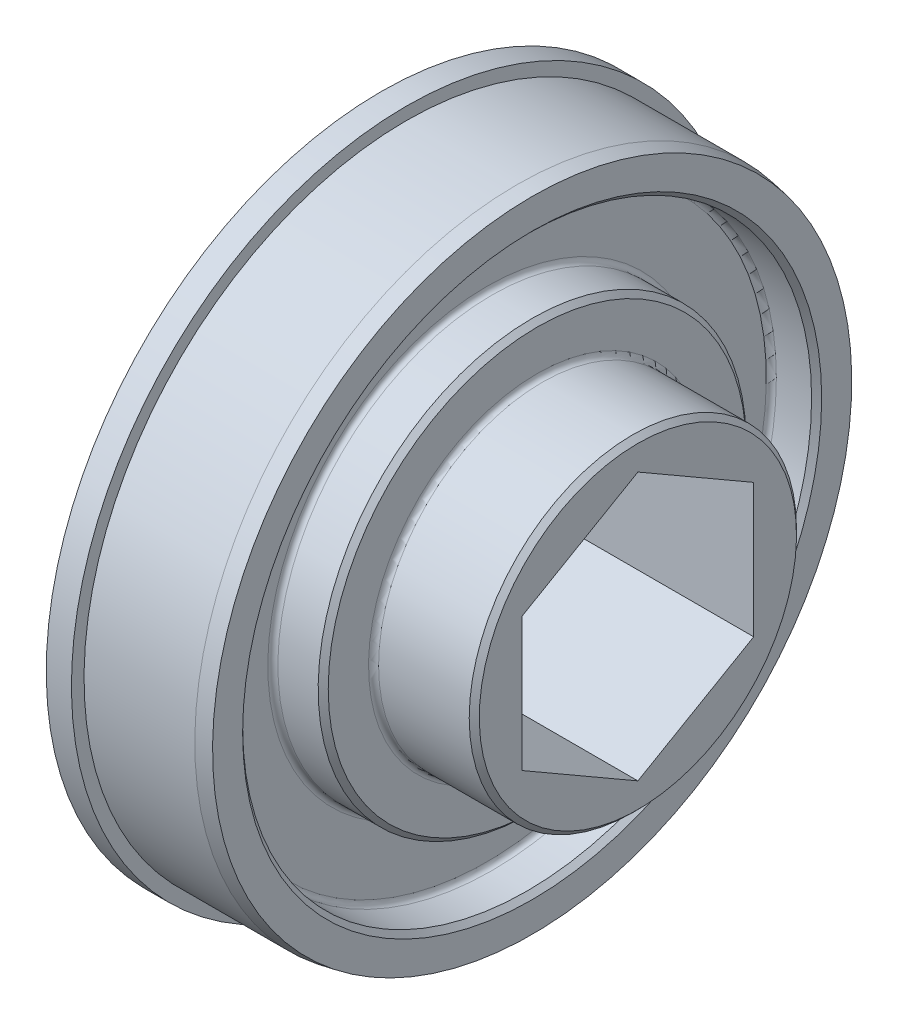
from build123d import *

# Parameters (mm, degrees)
CUT_EXTRUDE_1_DEPTH = 119.441968913


with BuildPart() as part:
    # Эскиз1 → Повернуть1 (revolve)
    with BuildSketch(Plane.XY):
        with BuildLine():
            Line((0, 0), (-57, 0))
            Line((-57, 0), (-57, 27.5))
            Line((-57, 27.5), (-72, 27.5))
            Line((-72, 27.5), (-72, 31.5))
            Line((-72, 31.5), (-71, 32.5))
            Line((-71, 32.5), (-53, 32.5))
            ThreePointArc((-53, 32.5), (-52.292893219, 32.792893219), (-52, 33.5))
            Line((-52, 33.5), (-52, 41.5))
            Line((-52, 41.5), (-51, 42.5))
            Line((-51, 42.5), (-43, 42.5))
            ThreePointArc((-43, 42.5), (-42.292893219, 42.792893219), (-42, 43.5))
            Line((-42, 43.5), (-42, 55.5))
            ThreePointArc((-42, 55.5), (-42.292893219, 56.207106781), (-43, 56.5))
            Line((-43, 56.5), (-50, 56.5))
            Line((-50, 56.5), (-51, 57.5))
            Line((-51, 57.5), (-51, 66.5))
            Line((-51, 66.5), (-46, 66.5))
            Line((-46, 66.5), (-46, 64))
            Line((-46, 64), (-24, 64))
            Line((-24, 64), (-21, 63.471019058))
            Line((-21, 63.471019058), (-21, 57.5))
            Line((-21, 57.5), (-22, 56.5))
            Line((-22, 56.5), (-29, 56.5))
            ThreePointArc((-29, 56.5), (-29.707106781, 56.207106781), (-30, 55.5))
            Line((-30, 55.5), (-30, 43.5))
            ThreePointArc((-30, 43.5), (-29.707106781, 42.792893219), (-29, 42.5))
            Line((-29, 42.5), (-21, 42.5))
            Line((-21, 42.5), (-20, 41.5))
            Line((-20, 41.5), (-20, 33.5))
            ThreePointArc((-20, 33.5), (-19.707106781, 32.792893219), (-19, 32.5))
            Line((-19, 32.5), (-1, 32.5))
            Line((-1, 32.5), (0, 31.5))
            Line((0, 31.5), (0, 0))
        make_face()
    revolve(axis=Axis((0, 0, 0), (-1, 0, 0)))

    # Эскиз2 → Вырез-Вытянуть1 (cut, through all)
    with BuildSketch(Plane(origin=(0, 0, 0), x_dir=(0, 0, -1), z_dir=(1, 0, 0))):
        Polygon((0, 26.558112383), (-23, 13.279056191), (-23, -13.279056191), (0, -26.558112383), (23, -13.279056191), (23, 13.279056191), align=None)
    extrude(amount=-CUT_EXTRUDE_1_DEPTH, mode=Mode.SUBTRACT)


solid = part.part
